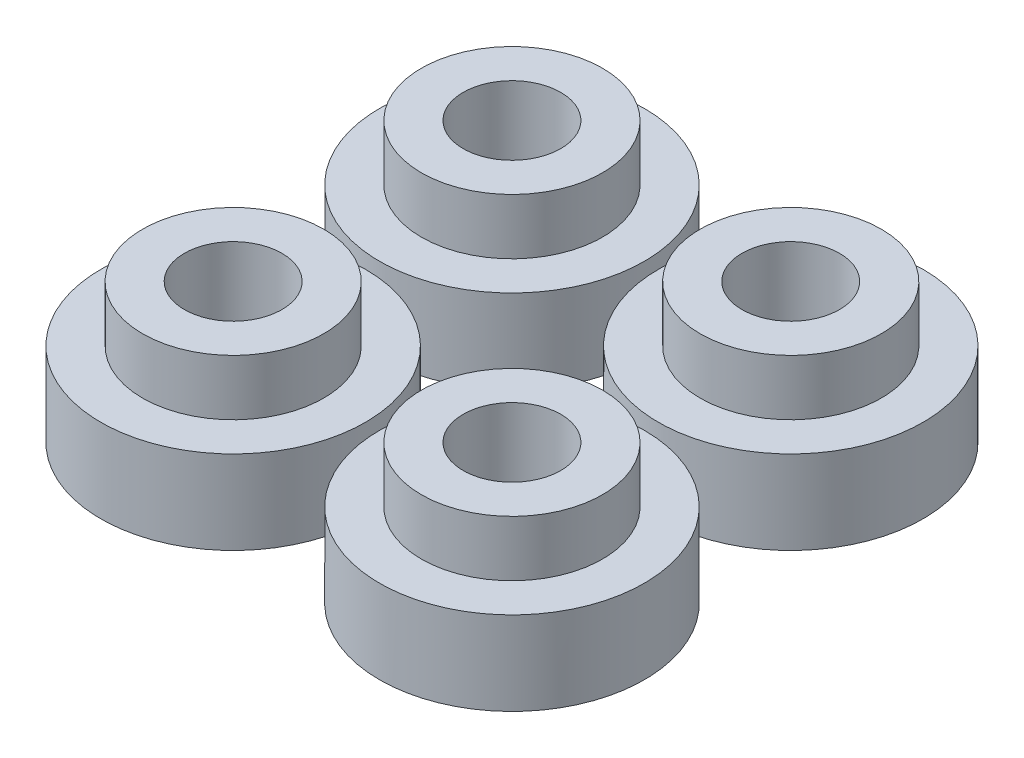
from build123d import *

# Parameters (mm, degrees)
SKETCH3_W            = 10
SKETCH3_H            = 10
BOSS_EXTRUDE1_DEPTH  = 10
LPATTERN2_COUNT      = 2
LPATTERN2_PITCH      = 10
LPATTERN2_COUNT_DIR2 = 2
LPATTERN2_PITCH_DIR2 = 10
SKETCH4_W            = 10
SKETCH4_H            = 10
CUT_EXTRUDE1_DEPTH   = 10


with BuildPart() as part:
    # Sketch1 → Revolve1 (revolve)
    with BuildSketch(Plane.XY, mode=Mode.PRIVATE) as revolve1_sk:
        Polygon((1.75, 0), (1.75, 5), (3.25, 5), (3.25, 3), (4.75, 3), (4.75, 0), align=None)
    revolve1 = revolve(revolve1_sk.sketch.rotate(Axis((0, 0, 0), (0, 1, 0)), 90), axis=Axis((0, 0, 0), (0, 1, 0)))

    # Sketch3 → Boss-Extrude1 (add)
    with BuildSketch(Plane.XZ):
        with Locations((5, 5)):
            Rectangle(SKETCH3_W, SKETCH3_H)
    extrude(amount=BOSS_EXTRUDE1_DEPTH)

    # LPattern2: Revolve1 2 × 2
    with Locations(*[(j * LPATTERN2_PITCH_DIR2, 0, i * LPATTERN2_PITCH) for i in range(LPATTERN2_COUNT) for j in range(LPATTERN2_COUNT_DIR2) if (i, j) != (0, 0)]):
        add(revolve1)

    # Sketch4 → Cut-Extrude1 (cut)
    with BuildSketch(Plane.XZ.offset(10)):
        with Locations((5, 5)):
            Rectangle(SKETCH4_W, SKETCH4_H)
    extrude(amount=-CUT_EXTRUDE1_DEPTH, mode=Mode.SUBTRACT)


with BuildPart() as cut_extrude1_piece_1:
    # of the separate pieces the step leaves, piece 1, a body of its own (cut_extrude1_pieces)
    add(part.part.solids().sort_by_distance((10, 3, 5.25))[0])


with BuildPart() as cut_extrude1_piece_2:
    # of the separate pieces the step leaves, piece 2, a body of its own (cut_extrude1_pieces)
    add(part.part.solids().sort_by_distance((10, 0, -4.75))[0])


with BuildPart() as cut_extrude1_piece_3:
    # of the separate pieces the step leaves, piece 3, a body of its own (cut_extrude1_pieces)
    add(part.part.solids().sort_by_distance((0, 0, 8.25))[0])


with BuildPart() as cut_extrude1_piece_4:
    # of the separate pieces the step leaves, piece 4, a body of its own (cut_extrude1_pieces)
    add(part.part.solids().sort_by_distance((0, 0, -1.75))[0])


solid = Compound([cut_extrude1_piece_1.part, cut_extrude1_piece_2.part, cut_extrude1_piece_3.part, cut_extrude1_piece_4.part])
